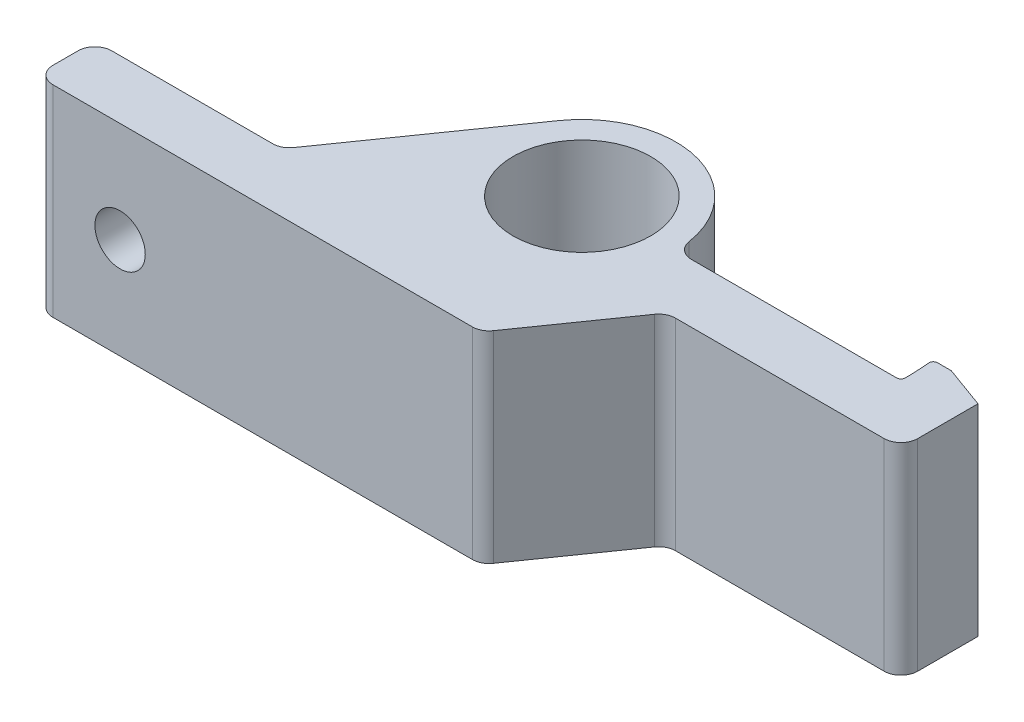
from build123d import *

# Parameters (mm, degrees)
SKETCH1_R             = 4.1
BOSS_EXTRUDE1_DEPTH   = 6
F_3_0MM_DOWEL_HOLE1_D = 3
BOSS_EXTRUDE3_DEPTH   = 12
FILLET1_R             = 0.25
FILLET3_R             = 1
CUT_EXTRUDE3_DEPTH    = 12


with BuildPart() as part:
    # Sketch1 → Boss-Extrude1 (new, symmetric)
    with BuildSketch(Plane(origin=(0, 0, 0), x_dir=(1, 0, 0), z_dir=(0, 1, 0))):
        with BuildLine():
            Line((0, 0), (26.5, 0))
            Line((26.5, 0), (31.051348998, 6.5))
            Line((31.051348998, 6.5), (45, 6.5))
            Line((45, 6.5), (45, 12))
            Line((45, 12), (41.5, 12))
            Line((41.5, 12), (41.5, 10))
            Line((41.5, 10), (28.1, 10))
            ThreePointArc((28.1, 10), (24.183952477, 15.340814924), (17.912748552, 13.212028044))
            Line((17.912748552, 13.212028044), (11.112313305, 3.5))
            Line((11.112313305, 3.5), (0, 3.5))
            Line((0, 3.5), (0, 0))
        make_face()
        with Locations(Location((22.5, 10, 0), (0, 0, 270))):
            Circle(SKETCH1_R, mode=Mode.SUBTRACT)
    extrude(amount=BOSS_EXTRUDE1_DEPTH, both=True)

    # Ø3.0mm Dowel Hole1 (through all)
    with Locations(Plane.XY):
        with Locations((5, 0)):
            Hole(F_3_0MM_DOWEL_HOLE1_D / 2)

    # Sketch5 → Boss-Extrude3 (add)
    with BuildSketch(Plane(origin=(0, 6, 0), x_dir=(1, 0, 0), z_dir=(0, 1, 0))):
        with BuildLine():
            Line((41.5, 12), (41.5, 10.5))
            ThreePointArc((41.5, 10.5), (41.465364553, 11.250978566), (41.401058171, 12))
            Line((41.401058171, 12), (41.5, 12))
        make_face()
    extrude(amount=-BOSS_EXTRUDE3_DEPTH)

    # Fillet1
    fillet1_edges = [part.edges().sort_by_distance(p)[0] for p in [
        (41.5, 0, -10),
        (41.401058171, 0, -12),
    ]]
    fillet(fillet1_edges, radius=FILLET1_R)

    # Fillet3
    fillet3_edges = [part.edges().sort_by_distance(p)[0] for p in [
        (31.051348998, 0, -6.5),
        (26.5, 0, 0),
        (0, 0, 0),
        (0, 0, -3.5),
        (11.112313305, 0, -3.5),
        (28.1, 0, -10),
        (45, 0, -6.5),
    ]]
    fillet(fillet3_edges, radius=FILLET3_R)

    # Sketch8 → Cut-Extrude3 (cut)
    with BuildSketch(Plane(origin=(0, 6, 0), x_dir=(1, 0, 0), z_dir=(0, 1, 0))):
        Polygon((45, 12), (42.5, 12), (45, 11.090074414), align=None)
    extrude(amount=-CUT_EXTRUDE3_DEPTH, mode=Mode.SUBTRACT)


solid = part.part
